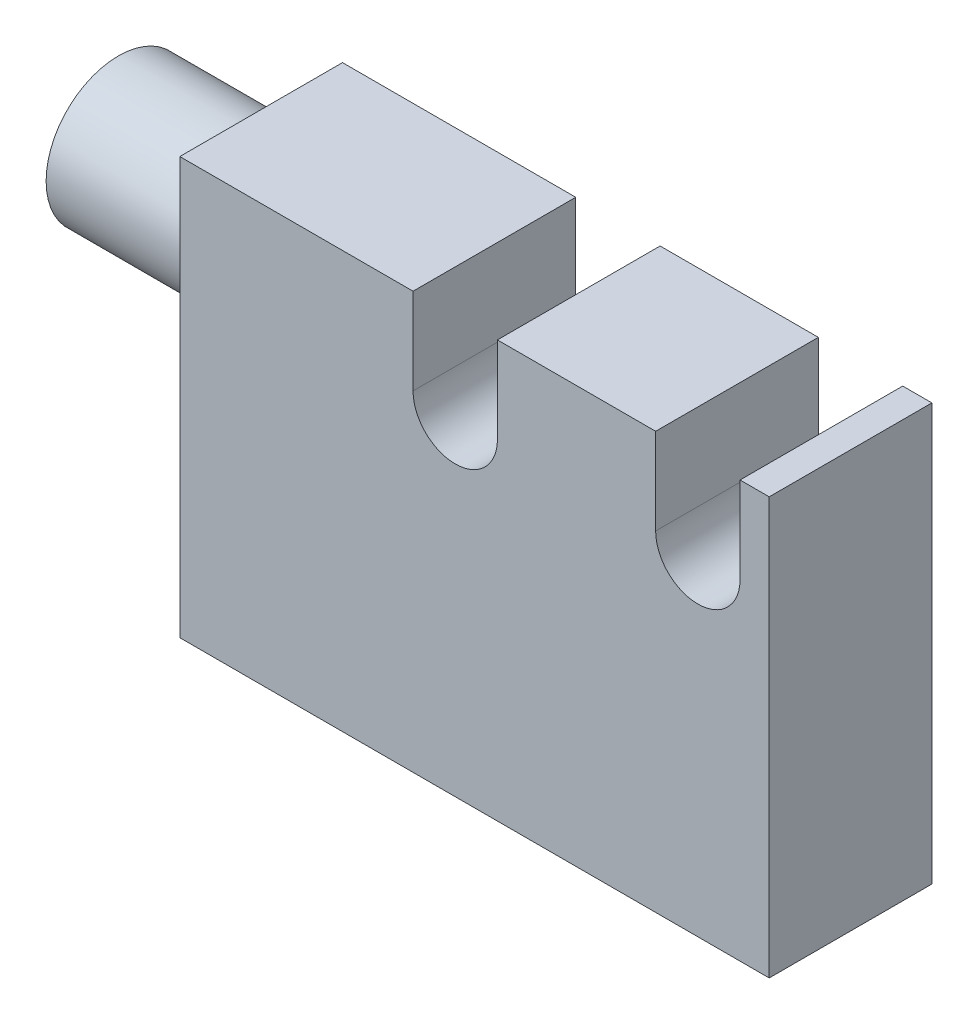
from build123d import *

# Parameters (mm, degrees)
BOSS_EXTRUDE1_DEPTH = 11.4
SKETCH2_W           = 41.3
SKETCH2_H           = 11.4
BOSS_EXTRUDE2_DEPTH = 16.2
SKETCH3_R           = 5.068211815
BOSS_EXTRUDE3_DEPTH = 10


with BuildPart() as part:
    # Sketch1 → Boss-Extrude1 (new body)
    with BuildSketch(Plane.XY):
        with BuildLine():
            Line((0, 0), (-41.3, 0))
            Line((-41.3, 0), (-41.3, 13))
            Line((-41.3, 13), (-24.95603272, 13))
            Line((-24.95603272, 13), (-24.95603272, 6.95))
            ThreePointArc((-24.95603272, 6.95), (-22, 3.99396728), (-19.04396728, 6.95))
            Line((-19.04396728, 6.95), (-19.04396728, 13))
            Line((-19.04396728, 13), (-7.95603272, 13))
            Line((-7.95603272, 13), (-7.95603272, 6.95))
            ThreePointArc((-7.95603272, 6.95), (-5, 3.99396728), (-2.04396728, 6.95))
            Line((-2.04396728, 6.95), (-2.04396728, 13))
            Line((-2.04396728, 13), (0, 13))
            Line((0, 13), (0, 0))
        make_face()
    extrude(amount=BOSS_EXTRUDE1_DEPTH)

    # Sketch2 → Boss-Extrude2 (add)
    with BuildSketch(Plane.XZ):
        with Locations((-20.65, 5.7)):
            Rectangle(SKETCH2_W, SKETCH2_H)
    extrude(amount=BOSS_EXTRUDE2_DEPTH)

    # Sketch3 → Boss-Extrude3 (add)
    with BuildSketch(Plane.ZY.offset(41.3)):
        with Locations(Location((5.7, 6.192096644, 0), (0, 0, 90))):
            Circle(SKETCH3_R)
    extrude(amount=BOSS_EXTRUDE3_DEPTH)


solid = part.part
